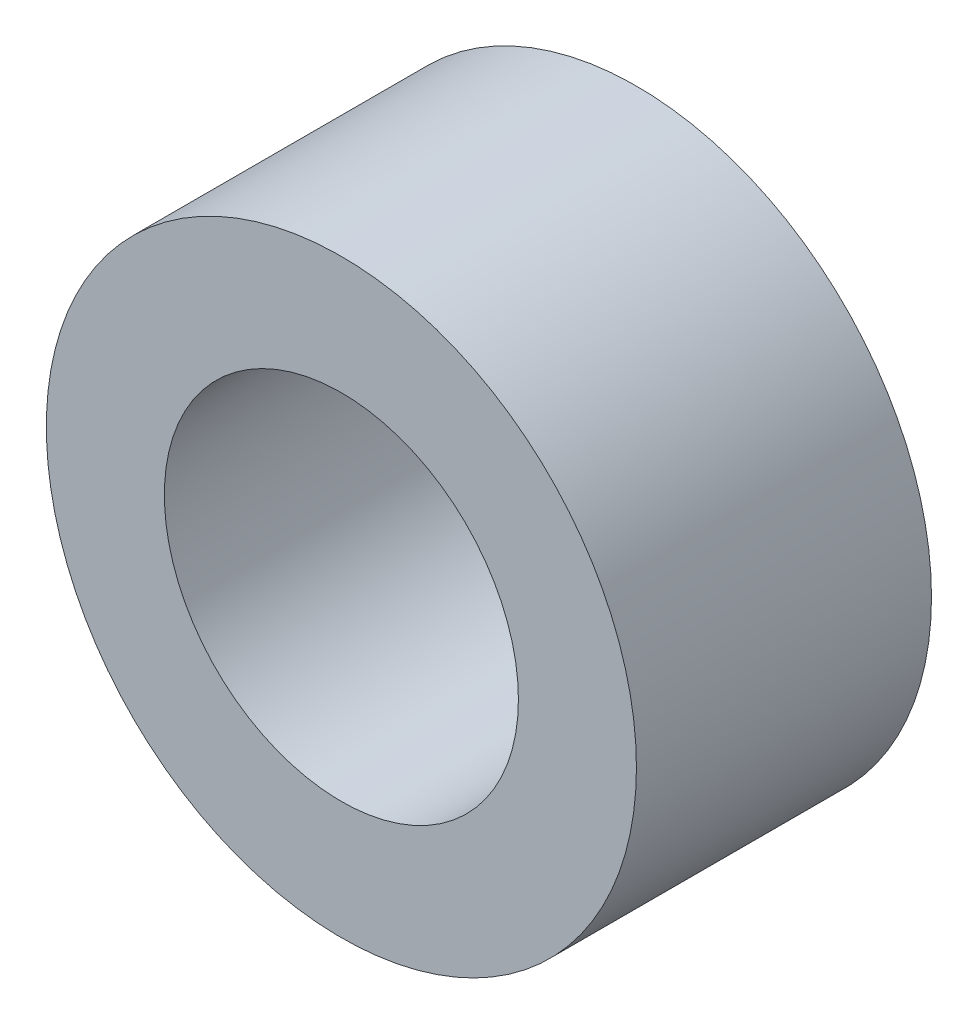
from build123d import *

# Parameters (mm, degrees)
SKETCH1_R           = 5
SKETCH1_R_2         = 3
BOSS_EXTRUDE1_DEPTH = 5


with BuildPart() as part:
    # Sketch1 → Boss-Extrude1 (new body)
    with BuildSketch(Plane.XY):
        Circle(SKETCH1_R)
        Circle(SKETCH1_R_2, mode=Mode.SUBTRACT)
    extrude(amount=BOSS_EXTRUDE1_DEPTH)


solid = part.part
